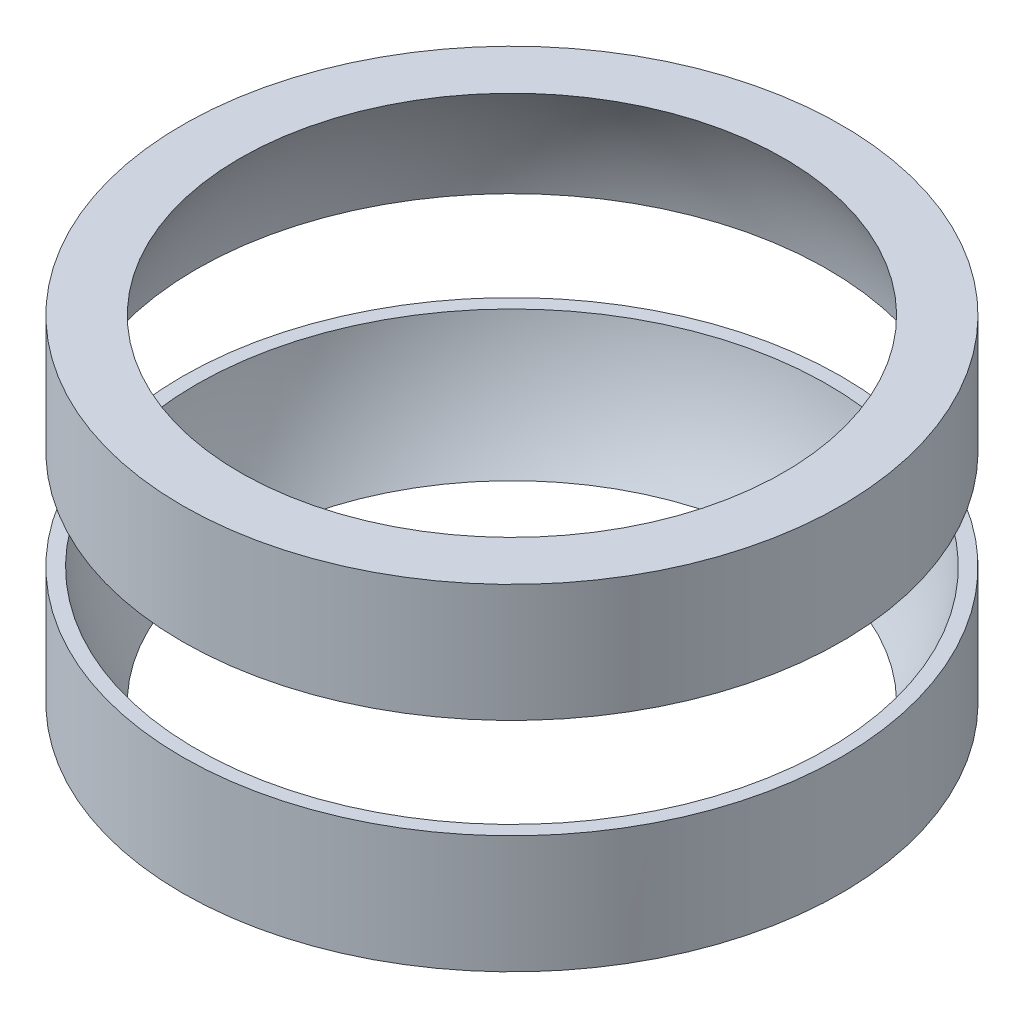
from build123d import *

# Parameters (mm, degrees)
CUT_EXTRUDE1_DEPTH      = 13.400201611
CUT_EXTRUDE1_DEPTH_BACK = 13.400201611
SKETCH3_W               = 16.5
SKETCH3_H               = 2.5


with BuildPart() as part:
    # Sketch2 → Revolve1 (revolve)
    with BuildSketch(Plane.XY):
        with BuildLine():
            Line((-8.25, -4.2), (-8.25, 4.2))
            Line((-8.25, 4.2), (-6.808817812, 4.2))
            ThreePointArc((-6.808817812, 4.2), (-8, 0), (-6.808817812, -4.2))
            Line((-6.808817812, -4.2), (-8.25, -4.2))
        make_face()
    revolve(axis=Axis((0, 4.2, 0), (0, -1, 0)))

    # Sketch3 → Cut-Extrude1 (cut, two sides: drawn at the far end of the back side and taken through both)
    with BuildSketch(Plane.XY.offset(-CUT_EXTRUDE1_DEPTH_BACK)):
        Rectangle(SKETCH3_W, SKETCH3_H)
    extrude(amount=CUT_EXTRUDE1_DEPTH + CUT_EXTRUDE1_DEPTH_BACK, mode=Mode.SUBTRACT)


with BuildPart() as cut_extrude1_piece_1:
    # of the separate pieces the step leaves, piece 1, a body of its own (cut_extrude1_pieces)
    add(part.part.solids().sort_by_distance((-6.808817812, -4.2, 0))[0])


with BuildPart() as cut_extrude1_piece_2:
    # of the separate pieces the step leaves, piece 2, a body of its own (cut_extrude1_pieces)
    add(part.part.solids().sort_by_distance((-6.808817812, 4.2, 0))[0])


solid = Compound([cut_extrude1_piece_1.part, cut_extrude1_piece_2.part])
